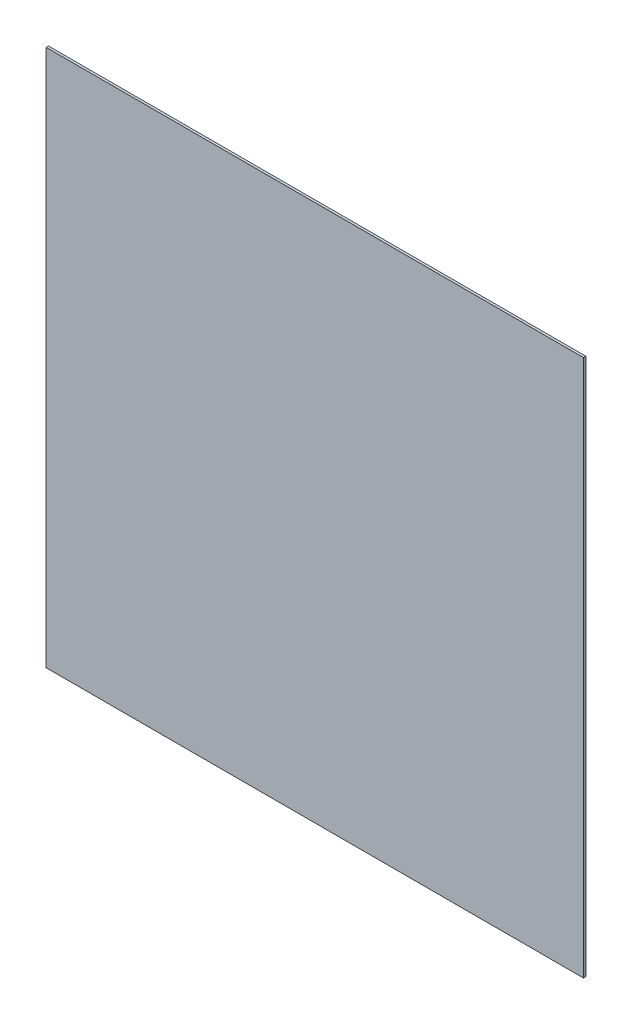
from build123d import *

# Parameters (mm, degrees)
SKETCH1_W           = 114.940249422
SKETCH1_H           = 114.940249422
BOSS_EXTRUDE1_DEPTH = 0.508


with BuildPart() as part:
    # Sketch1 → Boss-Extrude1 (new body)
    with BuildSketch(Plane.XY):
        Rectangle(SKETCH1_W, SKETCH1_H)
    extrude(amount=BOSS_EXTRUDE1_DEPTH)


solid = part.part
